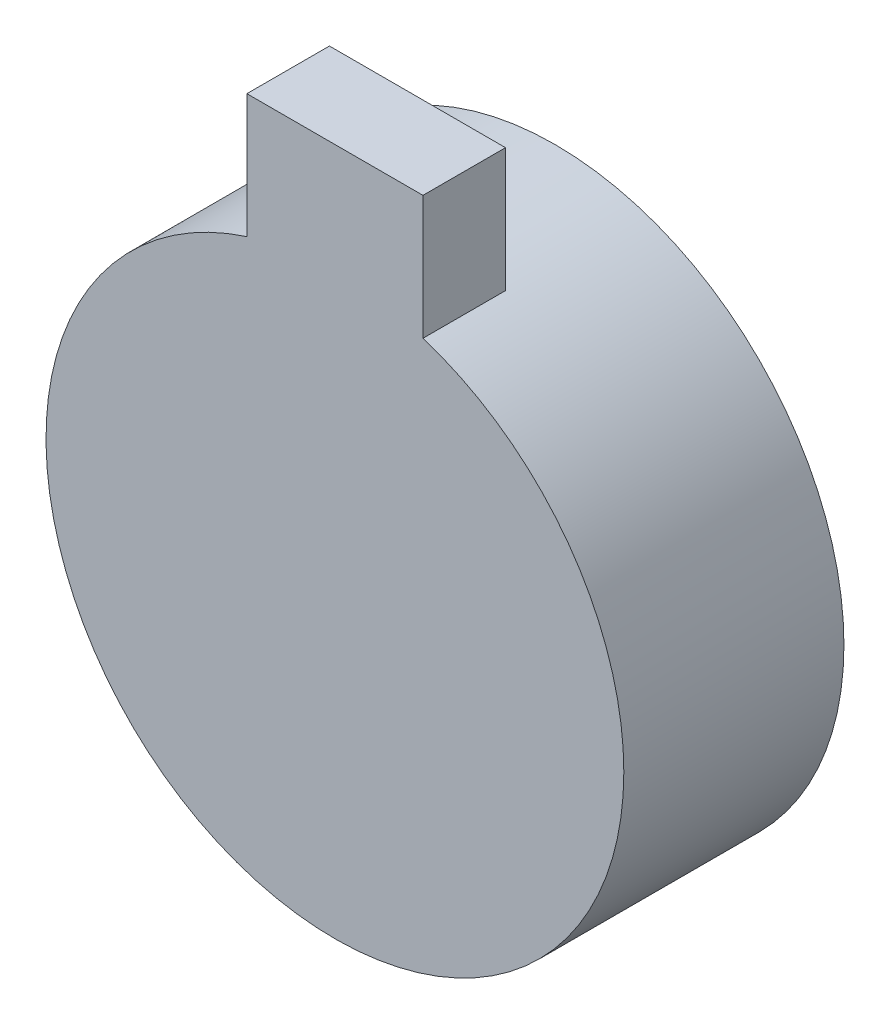
from build123d import *

# Parameters (mm, degrees)
SKIZZE1_R                       = 5.25
AUFSATZ_LINEAR_AUSTRAGEN1_DEPTH = 4
SKIZZE2_W                       = 3.2
SKIZZE2_H                       = 7.25
AUFSATZ_LINEAR_AUSTRAGEN2_DEPTH = 1.5


with BuildPart() as part:
    # Skizze1 → Aufsatz-Linear austragen1 (new body)
    with BuildSketch(Plane.XY):
        with Locations((-117.143982167, 15.456381225)):
            Circle(SKIZZE1_R)
    extrude(amount=-AUFSATZ_LINEAR_AUSTRAGEN1_DEPTH)

    # Skizze2 → Aufsatz-Linear austragen2 (add)
    with BuildSketch(Plane.XY):
        with Locations((-117.143982167, 19.081381225)):
            Rectangle(SKIZZE2_W, SKIZZE2_H)
    extrude(amount=-AUFSATZ_LINEAR_AUSTRAGEN2_DEPTH)


solid = part.part
